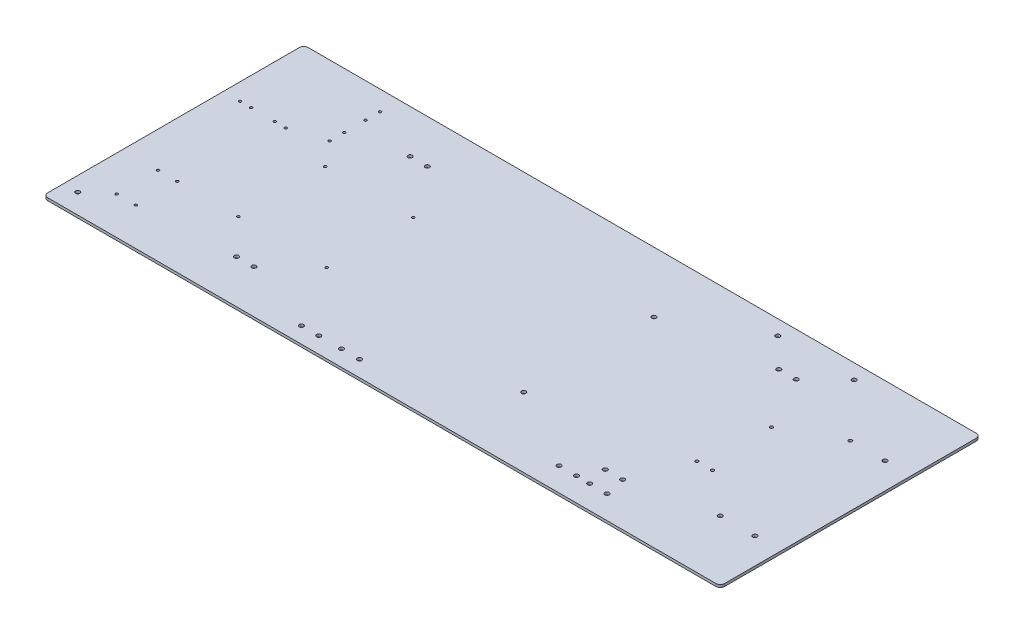
from build123d import *

# Parameters (mm, degrees)
SKETCH2_W           = 780
SKETCH2_H           = 300
BOSS_EXTRUDE1_DEPTH = 3
FILLET1_R           = 5
SKETCH4_R           = 2.5
SKETCH4_R_2         = 1.5
SKETCH4_R_3         = 1.75
SKETCH4_R_4         = 2
CUT_EXTRUDE3_DEPTH  = 10


with BuildPart() as part:
    # Sketch2 → Boss-Extrude1 (new body)
    with BuildSketch(Plane(origin=(0, 0, 0), x_dir=(1, 0, 0), z_dir=(0, 1, 0))):
        Rectangle(SKETCH2_W, SKETCH2_H)
    extrude(amount=BOSS_EXTRUDE1_DEPTH)

    # Fillet1
    fillet1_edges = [part.edges().sort_by_distance(p)[0] for p in [
        (-390, 1.5, -150),
        (390, 1.5, -150),
        (390, 1.5, 150),
        (-390, 1.5, 150),
    ]]
    fillet(fillet1_edges, radius=FILLET1_R)

    # Sketch4 → Cut-Extrude3 (cut)
    with BuildSketch(Plane(origin=(0, 3, 0), x_dir=(1, 0, 0), z_dir=(0, 1, 0))):
        with Locations(Location((83.321450778, 80.295408127, 0), (0, 0, 270))):
            Circle(SKETCH4_R)
        with Locations(Location((83.321450778, -69.803053448, 0), (0, 0, 270))):
            Circle(SKETCH4_R)
        with Locations(Location((173.53, 132.805328431, 0), (0, 0, 270))):
            Circle(SKETCH4_R)
        with Locations(Location((261.45, 132.805328431, 0), (0, 0, 270))):
            Circle(SKETCH4_R)
        with Locations(Location((207.49, 100, 0), (0, 0, 270))):
            Circle(SKETCH4_R)
        with Locations(Location((227.49, 100, 0), (0, 0, 270))):
            Circle(SKETCH4_R)
        with Locations(Location((-217.48, 100, 0), (0, 0, 270))):
            Circle(SKETCH4_R)
        with Locations(Location((-197.48, 100, 0), (0, 0, 270))):
            Circle(SKETCH4_R)
        with Locations(Location((-256.350622965, 40.95252289, 0), (0, 0, 270))):
            Circle(SKETCH4_R_2)
        with Locations(Location((-154.657613658, 40.95252289, 0), (0, 0, 270))):
            Circle(SKETCH4_R_2)
        with Locations(Location((-154.657613658, -58.997177687, 0), (0, 0, 270))):
            Circle(SKETCH4_R_2)
        with Locations(Location((-256.350622965, -58.997177687, 0), (0, 0, 270))):
            Circle(SKETCH4_R_2)
        with Locations(Location((360, -80, 0), (0, 0, 270))):
            Circle(SKETCH4_R)
        with Locations(Location((270, -38.928899428, 0), (0, 0, 270))):
            Circle(SKETCH4_R_3)
        with Locations(Location((261, 38.071100572, 0), (0, 0, 270))):
            Circle(SKETCH4_R_3)
        with Locations(Location((-279.342963389, 127.330547842, 0), (0, 0, 270))):
            Circle(SKETCH4_R_2)
        with Locations(Location((-279.342963389, 110.478563443, 0), (0, 0, 270))):
            Circle(SKETCH4_R_2)
        with Locations(Location((-279.342963389, 86.072241209, 0), (0, 0, 270))):
            Circle(SKETCH4_R_2)
        with Locations(Location((-279.342963389, 69.220256809, 0), (0, 0, 270))):
            Circle(SKETCH4_R_2)
        with Locations(Location((-330.292899545, 56.848781738, 0), (0, 0, 270))):
            Circle(SKETCH4_R_2)
        with Locations(Location((-317.508635517, 56.848781738, 0), (0, 0, 270))):
            Circle(SKETCH4_R_2)
        with Locations(Location((-370.506562807, 57.144862602, 0), (0, 0, 270))):
            Circle(SKETCH4_R_2)
        with Locations(Location((-357.72229878, 57.144862602, 0), (0, 0, 270))):
            Circle(SKETCH4_R_2)
        with Locations(Location((-348.907816262, -58.986021001, 0), (0, 0, 270))):
            Circle(SKETCH4_R_2)
        with Locations(Location((-326.82590567, -58.986021001, 0), (0, 0, 270))):
            Circle(SKETCH4_R_2)
        with Locations(Location((-348.907816262, -106.636459648, 0), (0, 0, 270))):
            Circle(SKETCH4_R_2)
        with Locations(Location((-326.82590567, -106.636459648, 0), (0, 0, 270))):
            Circle(SKETCH4_R_2)
        with Locations(Location((-373.368072028, -127.125603742, 0), (0, 0, 270))):
            Circle(SKETCH4_R)
        with Locations(Location((-111.216852198, -131.536821416, 0), (0, 0, 270))):
            Circle(SKETCH4_R)
        with Locations(Location((-91.146187886, -131.536821416, 0), (0, 0, 270))):
            Circle(SKETCH4_R)
        with Locations(Location((-65.026497621, -131.536821416, 0), (0, 0, 270))):
            Circle(SKETCH4_R)
        with Locations(Location((-44.144872529, -131.536821416, 0), (0, 0, 270))):
            Circle(SKETCH4_R)
        with Locations(Location((360, 70, 0), (0, 0, 270))):
            Circle(SKETCH4_R)
        with Locations(Location((177.03513318, -122.818153879, 0), (0, 0, 270))):
            Circle(SKETCH4_R)
        with Locations(Location((197.105797491, -122.818153879, 0), (0, 0, 270))):
            Circle(SKETCH4_R)
        with Locations(Location((207.49, -100, 0), (0, 0, 270))):
            Circle(SKETCH4_R)
        with Locations(Location((227.49, -100, 0), (0, 0, 270))):
            Circle(SKETCH4_R)
        with Locations(Location((320, -80, 0), (0, 0, 270))):
            Circle(SKETCH4_R)
        with Locations(Location((320, 70, 0), (0, 0, 270))):
            Circle(SKETCH4_R_4)
        with Locations(Location((252, -38.928899428, 0), (0, 0, 270))):
            Circle(SKETCH4_R_3)
        with Locations(Location((212.485538698, -123.057031719, 0), (0, 0, 270))):
            Circle(SKETCH4_R)
        with Locations(Location((232.556203009, -123.057031719, 0), (0, 0, 270))):
            Circle(SKETCH4_R)
        with Locations(Location((-217.48, -100, 0), (0, 0, 270))):
            Circle(SKETCH4_R)
        with Locations(Location((-197.48, -100, 0), (0, 0, 270))):
            Circle(SKETCH4_R)
    extrude(amount=-CUT_EXTRUDE3_DEPTH, mode=Mode.SUBTRACT)


solid = part.part
